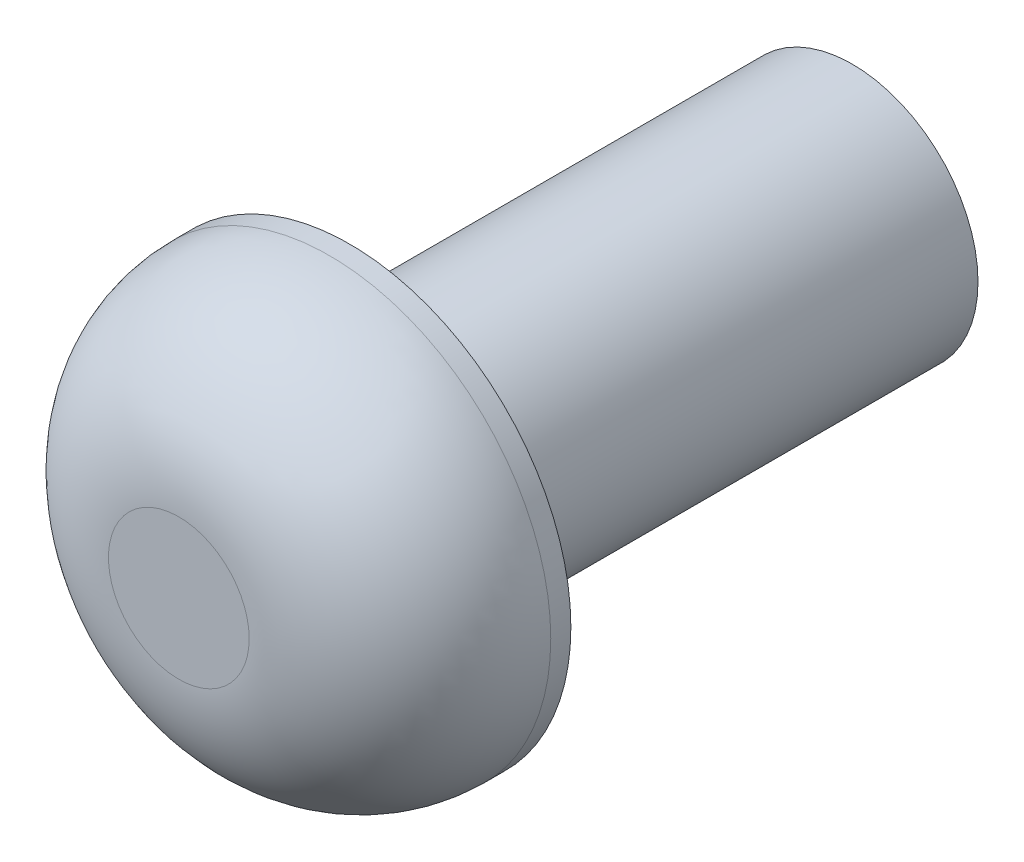
from build123d import *

# Parameters (mm, degrees)
SKETCH_1_R      = 2.5
EXTRUDE_1_DEPTH = 10
SKETCH_2_R      = 4.4
EXTRUDE_2_DEPTH = 3.4
FILLET_1_R      = 3


with BuildPart() as part:
    # 草图1 → 凸台-拉伸1 (new body)
    with BuildSketch(Plane.XY):
        Circle(SKETCH_1_R)
    extrude(amount=EXTRUDE_1_DEPTH)

    # 草图2 → 凸台-拉伸2 (add)
    with BuildSketch(Plane.XY.offset(10)):
        Circle(SKETCH_2_R)
    extrude(amount=EXTRUDE_2_DEPTH)

    # 圆角1
    fillet_1_edges = [part.edges().sort_by_distance(p)[0] for p in [
        (-4.4, 0, 13.4),
    ]]
    fillet(fillet_1_edges, radius=FILLET_1_R)


solid = part.part
